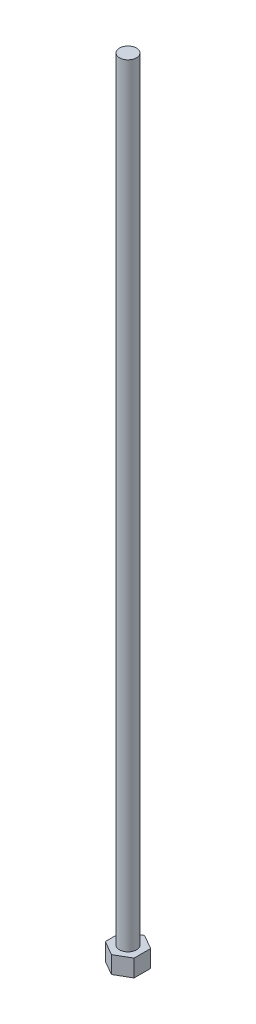
from build123d import *

# Parameters (mm, degrees)
BOSS_EXTRUDE1_DEPTH = 6
SKETCH2_R           = 2.95
BOSS_EXTRUDE2_DEPTH = 269


with BuildPart() as part:
    # Sketch1 → Boss-Extrude1 (new body)
    with BuildSketch(Plane(origin=(0, 0, 0), x_dir=(1, 0, 0), z_dir=(0, 1, 0))):
        Polygon((0, 5.773502692), (-5, 2.886751346), (-5, -2.886751346), (0, -5.773502692), (5, -2.886751346), (5, 2.886751346), align=None)
    extrude(amount=BOSS_EXTRUDE1_DEPTH)

    # Sketch2 → Boss-Extrude2 (add)
    with BuildSketch(Plane(origin=(0, 6, 0), x_dir=(1, 0, 0), z_dir=(0, 1, 0))):
        with Locations(Location((0, 0, 0), (0, 0, 270))):
            Circle(SKETCH2_R)
    extrude(amount=BOSS_EXTRUDE2_DEPTH)


solid = part.part
